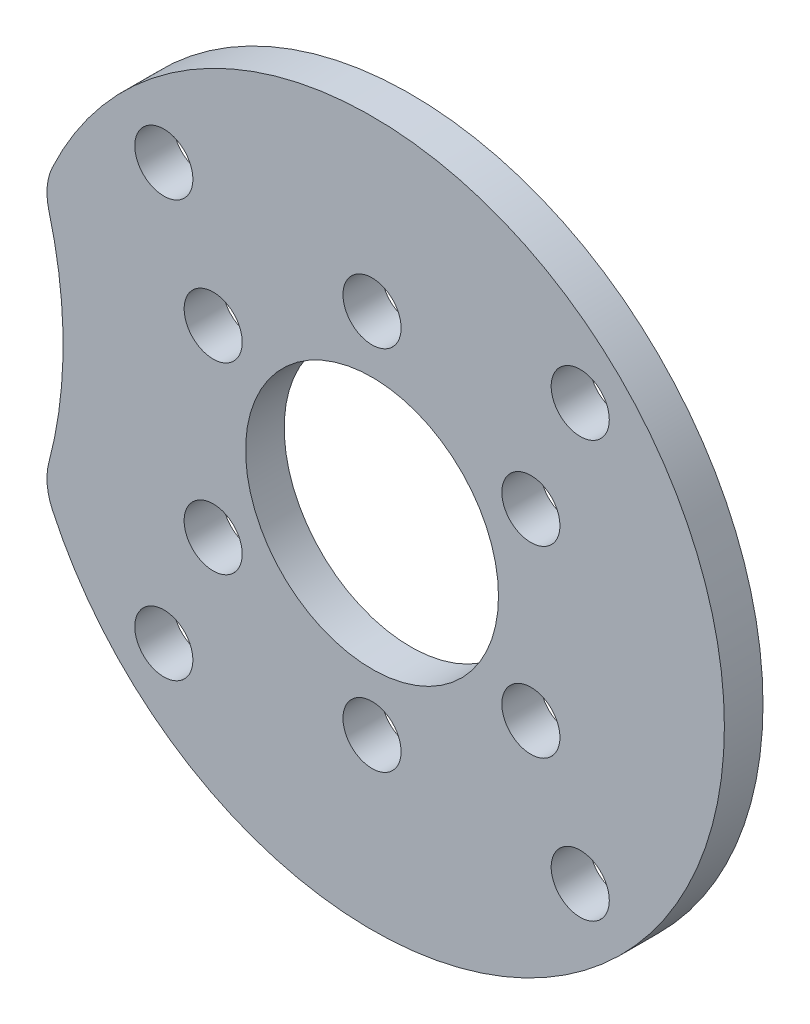
from build123d import *

# Parameters (mm, degrees)
SKETCH_1_R               = 18.25
SKETCH_1_R_2             = 6.55
EXTRUDE_1_DEPTH          = 2
SKETCH_2_R               = 22
CUT_EXTRUDE_1_DEPTH      = 2
SKETCH_3_R               = 1.505
CUT_EXTRUDE_2_DEPTH      = 2
PATTERN_CIRCULAR_1_COUNT = 2
SKETCH_4_R               = 1.505
CUT_EXTRUDE_3_DEPTH      = 2
FILLET_1_R               = 3


with BuildPart() as part:
    # 草图1 → 凸台-拉伸1 (new body)
    with BuildSketch(Plane.XY):
        Circle(SKETCH_1_R)
        Circle(SKETCH_1_R_2, mode=Mode.SUBTRACT)
    extrude(amount=EXTRUDE_1_DEPTH)

    # 草图2 → 切除-拉伸1 (cut)
    with BuildSketch(Plane.XY.offset(2)):
        with Locations((-38, 0)):
            Circle(SKETCH_2_R)
    extrude(amount=-CUT_EXTRUDE_1_DEPTH, mode=Mode.SUBTRACT)

    # 草图3 → 切除-拉伸2 (cut)
    with BuildSketch(Plane.XY.offset(2)):
        with Locations((0, 9.5)):
            Circle(SKETCH_3_R)
        with Locations((8.227241336, -4.75)):
            Circle(SKETCH_3_R)
        with Locations((-8.227241336, -4.75)):
            Circle(SKETCH_3_R)
    cut_extrude_2 = extrude(amount=-CUT_EXTRUDE_2_DEPTH, mode=Mode.SUBTRACT)

    # 阵列(圆周)1: 切除-拉伸2 ×2 about axis
    pattern_circular_1_axis = Axis((0, 0, 0), (0, 0, 1))
    for i in range(1, PATTERN_CIRCULAR_1_COUNT):
        add(cut_extrude_2.rotate(pattern_circular_1_axis, i * 360 / PATTERN_CIRCULAR_1_COUNT), mode=Mode.SUBTRACT)

    # 草图4 → 切除-拉伸3 (cut)
    with BuildSketch(Plane.XY.offset(2)):
        with Locations((-10.783378413, 10.783378413)):
            Circle(SKETCH_4_R)
        with Locations((10.783378413, 10.783378413)):
            Circle(SKETCH_4_R)
        with Locations((10.783378413, -10.783378413)):
            Circle(SKETCH_4_R)
        with Locations((-10.783378413, -10.783378413)):
            Circle(SKETCH_4_R)
    extrude(amount=-CUT_EXTRUDE_3_DEPTH, mode=Mode.SUBTRACT)

    # 圆角1
    fillet_1_edges = [part.edges().sort_by_distance(p)[0] for p in [
        (-17.013980263, -6.60204329, 1),
        (-17.013980263, 6.60204329, 1),
    ]]
    fillet(fillet_1_edges, radius=FILLET_1_R)


solid = part.part
